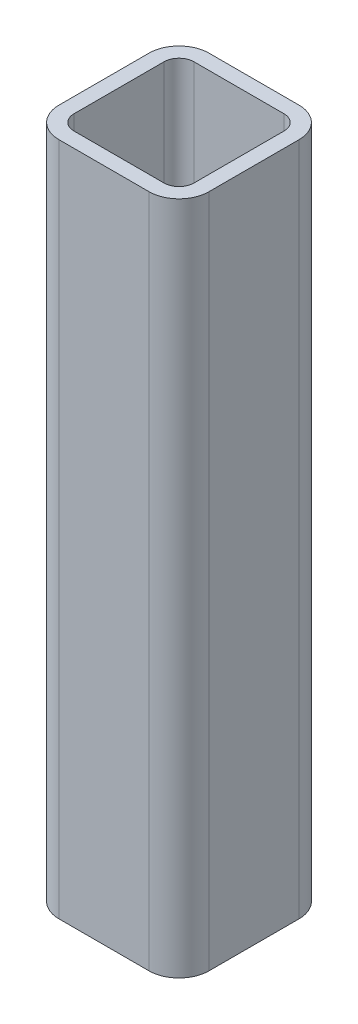
from build123d import *

# Parameters (mm, degrees)
SQUARE_TUBE_20_X_20_X_2_1_DEPTH = 90


with BuildPart() as part:
    # Sketch12 → Square tube 20 X 20 X 2(1) (new body)
    with BuildSketch(Plane(origin=(0, 0, 0), x_dir=(1, 0, 0), z_dir=(0, 1, 0))):
        with BuildLine():
            Line((-6, -10), (6, -10))
            ThreePointArc((6, -10), (8.828427125, -8.828427125), (10, -6))
            Line((10, -6), (10, 6))
            ThreePointArc((10, 6), (8.828427125, 8.828427125), (6, 10))
            Line((6, 10), (-6, 10))
            ThreePointArc((-6, 10), (-8.828427125, 8.828427125), (-10, 6))
            Line((-10, 6), (-10, -6))
            ThreePointArc((-10, -6), (-8.828427125, -8.828427125), (-6, -10))
        make_face()
        with BuildLine():
            Line((-6, -8), (6, -8))
            ThreePointArc((6, -8), (7.414213562, -7.414213562), (8, -6))
            Line((8, -6), (8, 6))
            ThreePointArc((8, 6), (7.414213562, 7.414213562), (6, 8))
            Line((6, 8), (-6, 8))
            ThreePointArc((-6, 8), (-7.414213562, 7.414213562), (-8, 6))
            Line((-8, 6), (-8, -6))
            ThreePointArc((-8, -6), (-7.414213562, -7.414213562), (-6, -8))
        make_face(mode=Mode.SUBTRACT)
    extrude(amount=SQUARE_TUBE_20_X_20_X_2_1_DEPTH)


solid = part.part
